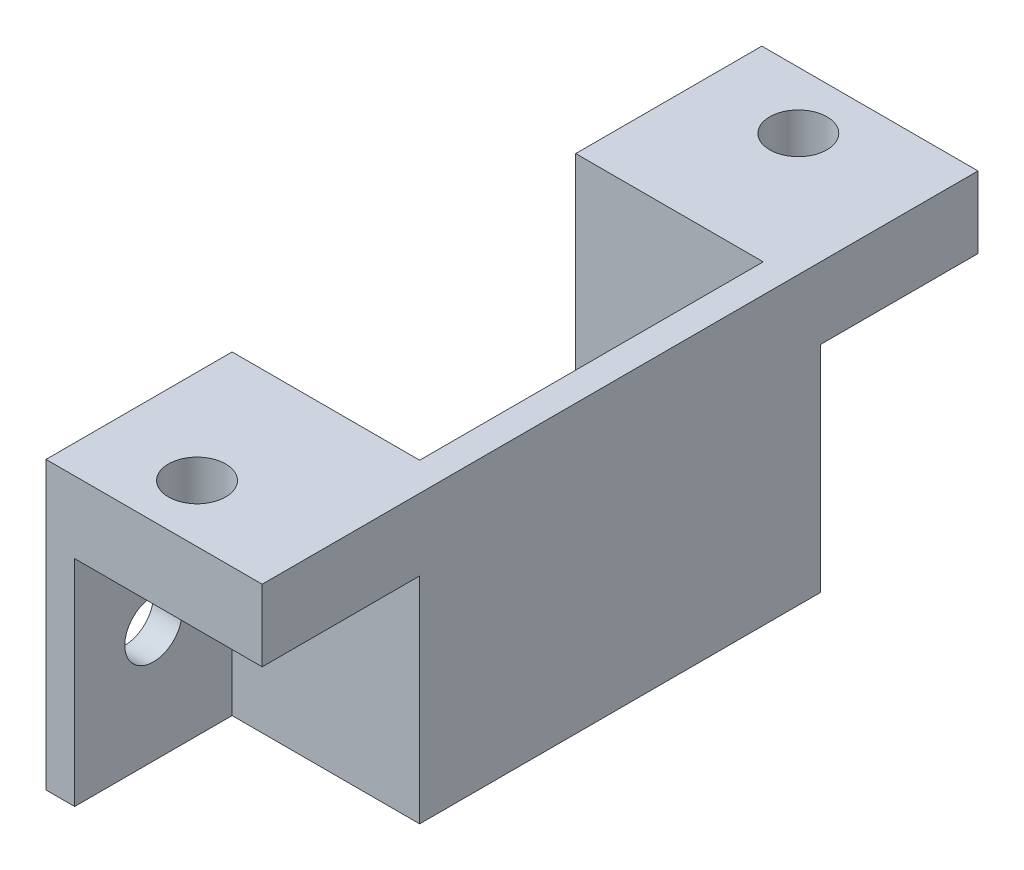
from build123d import *

# Parameters (mm, degrees)
BOSS_EXTRUDE1_DEPTH     = 20
CUT_EXTRUDE1_DEPTH      = 35.59205111
CUT_EXTRUDE1_DEPTH_BACK = 35.59205111
SKETCH4_R               = 2
BOSS_EXTRUDE2_START     = 20
BOSS_EXTRUDE2_DEPTH     = 5


with BuildPart() as part:
    # Sketch1 → Boss-Extrude1 (new body)
    with BuildSketch(Plane(origin=(0, 0, 0), x_dir=(1, 0, 0), z_dir=(0, 1, 0))):
        Polygon((15.1, -14), (15.1, 14), (2, 14), (2, 25), (0, 25), (0, 12), (13.1, 12), (13.1, -12), (0, -12), (0, -25), (2, -25), (2, -14), align=None)
    extrude(amount=BOSS_EXTRUDE1_DEPTH)

    # Sketch4 → Cut-Extrude1 (cut, two sides: drawn at the far end of the back side and taken through both)
    with BuildSketch(Plane(origin=(2, 0, 0), x_dir=(0, 0, -1), z_dir=(1, 0, 0)).offset(-CUT_EXTRUDE1_DEPTH_BACK)):
        with Locations((-19.5, 8)):
            Circle(SKETCH4_R)
        with Locations(Location((19.5, 8, 0), (0, 0, 180))):
            Circle(SKETCH4_R)
    extrude(amount=CUT_EXTRUDE1_DEPTH + CUT_EXTRUDE1_DEPTH_BACK, mode=Mode.SUBTRACT)

    # Sketch1<31> → Boss-Extrude2 (add)
    with BuildSketch(Plane(origin=(0, 0, 0), x_dir=(1, 0, 0), z_dir=(0, 1, 0)).offset(BOSS_EXTRUDE2_START)):
        with BuildLine():
            Line((15.1, -25), (15.1, -14))
            Line((15.1, -14), (6.55, -14))
            Line((6.55, -14), (6.55, -19))
            ThreePointArc((6.55, -19), (7.964213562, -19.585786438), (8.55, -21))
            ThreePointArc((8.55, -21), (7.964213562, -22.414213562), (6.55, -23))
            Line((6.55, -23), (6.55, -25))
            Line((6.55, -25), (15.1, -25))
        make_face()
        with BuildLine():
            Line((6.55, -19), (6.55, -14))
            Line((6.55, -14), (2, -14))
            Line((2, -14), (2, -25))
            Line((2, -25), (6.55, -25))
            Line((6.55, -25), (6.55, -23))
            ThreePointArc((6.55, -23), (4.55, -21), (6.55, -19))
        make_face()
        with BuildLine():
            Line((6.55, 14), (15.1, 14))
            Line((15.1, 14), (15.1, 25))
            Line((15.1, 25), (6.55, 25))
            Line((6.55, 25), (6.55, 23))
            ThreePointArc((6.55, 23), (7.964213562, 22.414213562), (8.55, 21))
            ThreePointArc((8.55, 21), (7.964213562, 19.585786438), (6.55, 19))
            Line((6.55, 19), (6.55, 14))
        make_face()
        with BuildLine():
            Line((2, 14), (6.55, 14))
            Line((6.55, 14), (6.55, 19))
            ThreePointArc((6.55, 19), (4.55, 21), (6.55, 23))
            Line((6.55, 23), (6.55, 25))
            Line((6.55, 25), (2, 25))
            Line((2, 25), (2, 14))
        make_face()
    extrude(amount=-BOSS_EXTRUDE2_DEPTH)


solid = part.part
